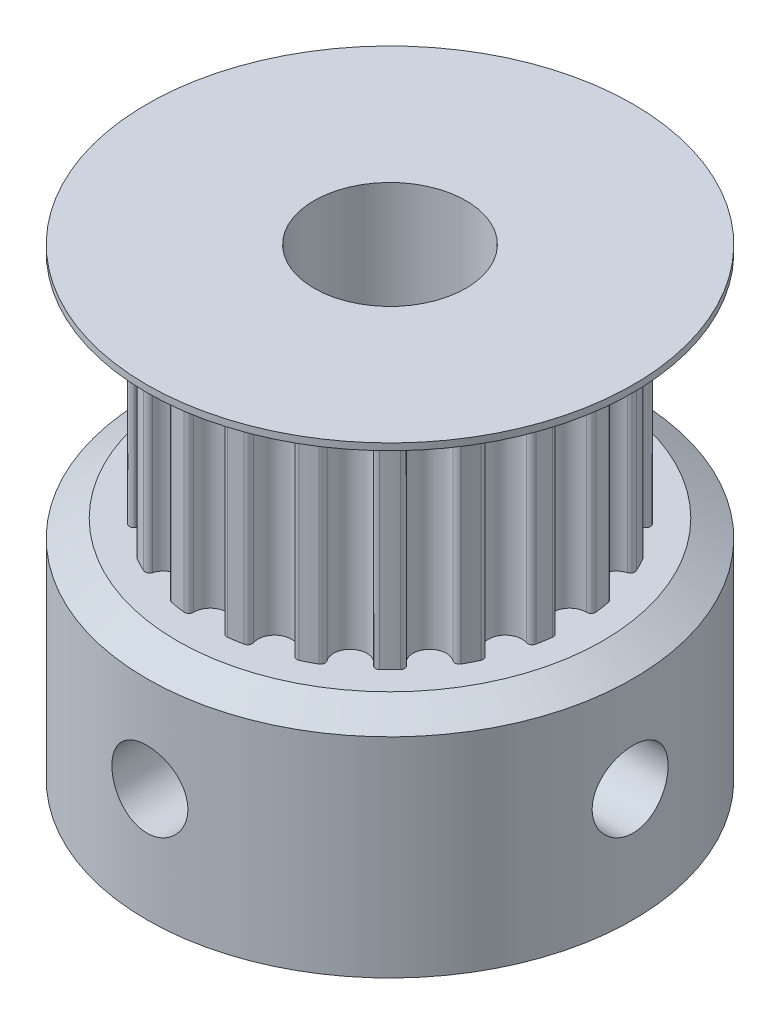
from build123d import *
from OCP.BRepFilletAPI import BRepFilletAPI_MakeChamfer

# Parameters (mm, degrees)
SKETCH_1_R               = 8
SKETCH_1_R_2             = 2.5
EXTRUDE_1_DEPTH          = 7.45
SKETCH_2_R               = 2.5
EXTRUDE_2_DEPTH          = 7
SKETCH_3_R               = 8
SKETCH_3_R_2             = 2.5
EXTRUDE_3_DEPTH          = 1.55
CUT_EXTRUDE_1_REACH      = 21.596
CUT_EXTRUDE_1_END_RADIUS = 8
SKETCH_4_R               = 1.25
CUT_EXTRUDE_2_REACH      = 21.596
CUT_EXTRUDE_2_END_RADIUS = 8
SKETCH_5_R               = 1.25
CHAMFER_1_SIZE           = 1
CHAMFER_1_SIZE2          = 0.577350269
CUT_EXTRUDE1_DEPTH       = 20.595918118
CUT_EXTRUDE1_DEPTH_BACK  = 0.75
SKETCH1_R                = 8


with BuildPart() as part:
    # Эскиз1 → Бобышка-Вытянуть1 (new body)
    with BuildSketch(Plane(origin=(0, 0, 0), x_dir=(1, 0, 0), z_dir=(0, 1, 0))):
        with Locations(Location((0, 0, 0), (0, 0, 270))):
            Circle(SKETCH_1_R)
        with Locations(Location((0, 0, 0), (0, 0, 270))):
            Circle(SKETCH_1_R_2, mode=Mode.SUBTRACT)
    extrude(amount=EXTRUDE_1_DEPTH)

    # Эскиз2 → Бобышка-Вытянуть2 (add)
    with BuildSketch(Plane(origin=(0, 7.45, 0), x_dir=(1, 0, 0), z_dir=(0, 1, 0))):
        with BuildLine():
            ThreePointArc((-2.557469435, 5.549004423), (-2.773881953, 5.444049863), (-2.985996064, 5.3306592))
            ThreePointArc((-2.985996064, 5.3306592), (-3.059404709, 5.231014138), (-3.032930262, 5.110113057))
            ThreePointArc((-3.032930262, 5.110113057), (-3.150528952, 4.33633109), (-3.922779328, 4.463599867))
            ThreePointArc((-3.922779328, 4.463599867), (-4.029582035, 4.526139051), (-4.14703464, 4.487115298))
            ThreePointArc((-4.14703464, 4.487115298), (-4.320422433, 4.320422433), (-4.487115298, 4.14703464))
            ThreePointArc((-4.487115298, 4.14703464), (-4.526139051, 4.029582035), (-4.463599867, 3.922779328))
            ThreePointArc((-4.463599867, 3.922779328), (-4.33633109, 3.150528952), (-5.110113057, 3.032930262))
            ThreePointArc((-5.110113057, 3.032930262), (-5.231014138, 3.059404709), (-5.3306592, 2.985996064))
            ThreePointArc((-5.3306592, 2.985996064), (-5.444049863, 2.773881953), (-5.549004423, 2.557469435))
            ThreePointArc((-5.549004423, 2.557469435), (-5.549823367, 2.433706366), (-5.457341217, 2.351456627))
            ThreePointArc((-5.457341217, 2.351456627), (-5.097662927, 1.65633109), (-5.797233315, 1.305376312))
            ThreePointArc((-5.797233315, 1.305376312), (-5.92039813, 1.293194518), (-5.992481697, 1.19258673))
            ThreePointArc((-5.992481697, 1.19258673), (-6.034775761, 0.955814581), (-6.067718334, 0.717561302))
            ThreePointArc((-6.067718334, 0.717561302), (-6.030252304, 0.599602562), (-5.916879985, 0.549956967))
            ThreePointArc((-5.916879985, 0.549956967), (-5.36, 0), (-5.916879985, -0.549956967))
            ThreePointArc((-5.916879985, -0.549956967), (-6.030252304, -0.599602562), (-6.067718334, -0.717561302))
            ThreePointArc((-6.067718334, -0.717561302), (-6.034775761, -0.955814581), (-5.992481697, -1.19258673))
            ThreePointArc((-5.992481697, -1.19258673), (-5.92039813, -1.293194518), (-5.797233315, -1.305376312))
            ThreePointArc((-5.797233315, -1.305376312), (-5.097662927, -1.65633109), (-5.457341217, -2.351456627))
            ThreePointArc((-5.457341217, -2.351456627), (-5.549823367, -2.433706366), (-5.549004423, -2.557469435))
            ThreePointArc((-5.549004423, -2.557469435), (-5.444049863, -2.773881953), (-5.3306592, -2.985996064))
            ThreePointArc((-5.3306592, -2.985996064), (-5.231014138, -3.059404709), (-5.110113057, -3.032930262))
            ThreePointArc((-5.110113057, -3.032930262), (-4.33633109, -3.150528952), (-4.463599867, -3.922779328))
            ThreePointArc((-4.463599867, -3.922779328), (-4.526139051, -4.029582035), (-4.487115298, -4.14703464))
            ThreePointArc((-4.487115298, -4.14703464), (-4.320422433, -4.320422433), (-4.14703464, -4.487115298))
            ThreePointArc((-4.14703464, -4.487115298), (-4.029582035, -4.526139051), (-3.922779328, -4.463599867))
            ThreePointArc((-3.922779328, -4.463599867), (-3.150528952, -4.33633109), (-3.032930262, -5.110113057))
            ThreePointArc((-3.032930262, -5.110113057), (-3.059404709, -5.231014138), (-2.985996064, -5.3306592))
            ThreePointArc((-2.985996064, -5.3306592), (-2.773881953, -5.444049863), (-2.557469435, -5.549004423))
            ThreePointArc((-2.557469435, -5.549004423), (-2.433706366, -5.549823367), (-2.351456627, -5.457341217))
            ThreePointArc((-2.351456627, -5.457341217), (-1.65633109, -5.097662927), (-1.305376312, -5.797233315))
            ThreePointArc((-1.305376312, -5.797233315), (-1.293194518, -5.92039813), (-1.19258673, -5.992481697))
            ThreePointArc((-1.19258673, -5.992481697), (-0.955814581, -6.034775761), (-0.717561302, -6.067718334))
            ThreePointArc((-0.717561302, -6.067718334), (-0.599602562, -6.030252304), (-0.549956967, -5.916879985))
            ThreePointArc((-0.549956967, -5.916879985), (0, -5.36), (0.549956967, -5.916879985))
            ThreePointArc((0.549956967, -5.916879985), (0.599602562, -6.030252304), (0.717561302, -6.067718334))
            ThreePointArc((0.717561302, -6.067718334), (0.955814581, -6.034775761), (1.19258673, -5.992481697))
            ThreePointArc((1.19258673, -5.992481697), (1.293194518, -5.92039813), (1.305376312, -5.797233315))
            ThreePointArc((1.305376312, -5.797233315), (1.65633109, -5.097662927), (2.351456627, -5.457341217))
            ThreePointArc((2.351456627, -5.457341217), (2.433706366, -5.549823367), (2.557469435, -5.549004423))
            ThreePointArc((2.557469435, -5.549004423), (2.773881953, -5.444049863), (2.985996064, -5.3306592))
            ThreePointArc((2.985996064, -5.3306592), (3.059404709, -5.231014138), (3.032930262, -5.110113057))
            ThreePointArc((3.032930262, -5.110113057), (3.150528952, -4.33633109), (3.922779328, -4.463599867))
            ThreePointArc((3.922779328, -4.463599867), (4.029582035, -4.526139051), (4.14703464, -4.487115298))
            ThreePointArc((4.14703464, -4.487115298), (4.320422433, -4.320422433), (4.487115298, -4.14703464))
            ThreePointArc((4.487115298, -4.14703464), (4.526139051, -4.029582035), (4.463599867, -3.922779328))
            ThreePointArc((4.463599867, -3.922779328), (4.33633109, -3.150528952), (5.110113057, -3.032930262))
            ThreePointArc((5.110113057, -3.032930262), (5.231014138, -3.059404709), (5.3306592, -2.985996064))
            ThreePointArc((5.3306592, -2.985996064), (5.444049863, -2.773881953), (5.549004423, -2.557469435))
            ThreePointArc((5.549004423, -2.557469435), (5.549823367, -2.433706366), (5.457341217, -2.351456627))
            ThreePointArc((5.457341217, -2.351456627), (5.097662927, -1.65633109), (5.797233315, -1.305376312))
            ThreePointArc((5.797233315, -1.305376312), (5.92039813, -1.293194518), (5.992481697, -1.19258673))
            ThreePointArc((5.992481697, -1.19258673), (6.034775761, -0.955814581), (6.067718334, -0.717561302))
            ThreePointArc((6.067718334, -0.717561302), (6.030252304, -0.599602562), (5.916879985, -0.549956967))
            ThreePointArc((5.916879985, -0.549956967), (5.36, 0), (5.916879985, 0.549956967))
            ThreePointArc((5.916879985, 0.549956967), (6.030252304, 0.599602562), (6.067718334, 0.717561302))
            ThreePointArc((6.067718334, 0.717561302), (6.034775761, 0.955814581), (5.992481697, 1.19258673))
            ThreePointArc((5.992481697, 1.19258673), (5.92039813, 1.293194518), (5.797233315, 1.305376312))
            ThreePointArc((5.797233315, 1.305376312), (5.097662927, 1.65633109), (5.457341217, 2.351456627))
            ThreePointArc((5.457341217, 2.351456627), (5.549823367, 2.433706366), (5.549004423, 2.557469435))
            ThreePointArc((5.549004423, 2.557469435), (5.444049863, 2.773881953), (5.3306592, 2.985996064))
            ThreePointArc((5.3306592, 2.985996064), (5.231014138, 3.059404709), (5.110113057, 3.032930262))
            ThreePointArc((5.110113057, 3.032930262), (4.33633109, 3.150528952), (4.463599867, 3.922779328))
            ThreePointArc((4.463599867, 3.922779328), (4.526139051, 4.029582035), (4.487115298, 4.14703464))
            ThreePointArc((4.487115298, 4.14703464), (4.320422433, 4.320422433), (4.14703464, 4.487115298))
            ThreePointArc((4.14703464, 4.487115298), (4.029582035, 4.526139051), (3.922779328, 4.463599867))
            ThreePointArc((3.922779328, 4.463599867), (3.150528952, 4.33633109), (3.032930262, 5.110113057))
            ThreePointArc((3.032930262, 5.110113057), (3.059404709, 5.231014138), (2.985996064, 5.3306592))
            ThreePointArc((2.985996064, 5.3306592), (2.773881953, 5.444049863), (2.557469435, 5.549004423))
            ThreePointArc((2.557469435, 5.549004423), (2.433706366, 5.549823367), (2.351456627, 5.457341217))
            ThreePointArc((2.351456627, 5.457341217), (1.65633109, 5.097662927), (1.305376312, 5.797233315))
            ThreePointArc((1.305376312, 5.797233315), (1.293194518, 5.92039813), (1.19258673, 5.992481697))
            ThreePointArc((1.19258673, 5.992481697), (0.955814581, 6.034775761), (0.717561302, 6.067718334))
            ThreePointArc((0.717561302, 6.067718334), (0.599602562, 6.030252304), (0.549956967, 5.916879985))
            ThreePointArc((0.549956967, 5.916879985), (0, 5.36), (-0.549956967, 5.916879985))
            ThreePointArc((-0.549956967, 5.916879985), (-0.599602562, 6.030252304), (-0.717561302, 6.067718334))
            ThreePointArc((-0.717561302, 6.067718334), (-0.955814581, 6.034775761), (-1.19258673, 5.992481697))
            ThreePointArc((-1.19258673, 5.992481697), (-1.293194518, 5.92039813), (-1.305376312, 5.797233315))
            ThreePointArc((-1.305376312, 5.797233315), (-1.65633109, 5.097662927), (-2.351456627, 5.457341217))
            ThreePointArc((-2.351456627, 5.457341217), (-2.433706366, 5.549823367), (-2.557469435, 5.549004423))
        make_face()
        with Locations(Location((0, 0, 0), (0, 0, 270))):
            Circle(SKETCH_2_R, mode=Mode.SUBTRACT)
    extrude(amount=EXTRUDE_2_DEPTH)

    # Эскиз3 → Бобышка-Вытянуть3 (add)
    with BuildSketch(Plane(origin=(0, 14.45, 0), x_dir=(1, 0, 0), z_dir=(0, 1, 0))):
        with Locations(Location((0, 0, 0), (0, 0, 270))):
            Circle(SKETCH_3_R)
        with Locations(Location((0, 0, 0), (0, 0, 270))):
            Circle(SKETCH_3_R_2, mode=Mode.SUBTRACT)
    extrude(amount=EXTRUDE_3_DEPTH)

    # Вырез-Вытянуть1: up to this cylinder (the profile starts inside it)
    cut_extrude_1_end = Plane(origin=(0, 3.725, 0), z_dir=(0, -1, 0)) * Cylinder(CUT_EXTRUDE_1_END_RADIUS, 60.192, mode=Mode.PRIVATE)
    # Эскиз4 → Вырез-Вытянуть1 (cut, up to the surface)
    with BuildSketch(Plane.XY, mode=Mode.PRIVATE) as cut_extrude_1_sk1:
        with Locations(Location((0, 3.725, 0), (0, 0, 180))):
            Circle(SKETCH_4_R)
    cut_extrude_1_tool1 = extrude(cut_extrude_1_sk1.sketch, amount=CUT_EXTRUDE_1_REACH, mode=Mode.PRIVATE) & cut_extrude_1_end
    add(cut_extrude_1_tool1.solids().sort_by_distance((0, 3.725, 0))[0], mode=Mode.SUBTRACT)

    # Вырез-Вытянуть2: up to this cylinder (the profile starts inside it)
    cut_extrude_2_end = Plane(origin=(0, 3.725, 0), z_dir=(0, -1, 0)) * Cylinder(CUT_EXTRUDE_2_END_RADIUS, 60.192, mode=Mode.PRIVATE)
    # Эскиз5 → Вырез-Вытянуть2 (cut, up to the surface)
    with BuildSketch(Plane(origin=(0, 0, 0), x_dir=(0, 0, -1), z_dir=(1, 0, 0)), mode=Mode.PRIVATE) as cut_extrude_2_sk1:
        with Locations(Location((0, 3.725, 0), (0, 0, 180))):
            Circle(SKETCH_5_R)
    cut_extrude_2_tool1 = extrude(cut_extrude_2_sk1.sketch, amount=CUT_EXTRUDE_2_REACH, mode=Mode.PRIVATE) & cut_extrude_2_end
    add(cut_extrude_2_tool1.solids().sort_by_distance((0, 3.725, 0))[0], mode=Mode.SUBTRACT)

    # Фаска1: one chamfer whose edges measure the first distance from different faces: ONE call of the kernel's chamfer builder (chamfer() names one face for all edges)
    chamfer_1_edges_1 = [part.edges().sort_by_distance(p)[0] for p in [
        (0, 14.45, -8),
    ]]
    chamfer_1_side_1 = [part.faces().sort_by_distance(p)[0] for p in [
        (0, 14.45, -7.77372583),
    ]]
    chamfer_1_edges_2 = [part.edges().sort_by_distance(p)[0] for p in [
        (0, 7.45, -8),
    ]]
    chamfer_1_side_2 = [part.faces().sort_by_distance(p)[0] for p in [
        (0, 7.45, -7.77372583),
    ]]
    chamfer_1 = BRepFilletAPI_MakeChamfer(part.part.solid().wrapped)
    for e in chamfer_1_edges_1:
        chamfer_1.Add(CHAMFER_1_SIZE, CHAMFER_1_SIZE2, e.wrapped, chamfer_1_side_1[0].wrapped)  # the first distance lies on this face
    for e in chamfer_1_edges_2:
        chamfer_1.Add(CHAMFER_1_SIZE, CHAMFER_1_SIZE2, e.wrapped, chamfer_1_side_2[0].wrapped)  # the first distance lies on this face
    add(Compound.cast(chamfer_1.Shape()), mode=Mode.REPLACE)

    # Sketch1 → Cut-Extrude1 (cut, two sides: drawn at the far end of the back side and taken through both)
    with BuildSketch(Plane(origin=(0, 16, 0), x_dir=(1, 0, 0), z_dir=(0, 1, 0)).offset(-CUT_EXTRUDE1_DEPTH_BACK)):
        with Locations(Location((0, 0, 0), (0, 0, 90))):
            Circle(SKETCH1_R)
    extrude(amount=CUT_EXTRUDE1_DEPTH + CUT_EXTRUDE1_DEPTH_BACK, mode=Mode.SUBTRACT)


solid = part.part
